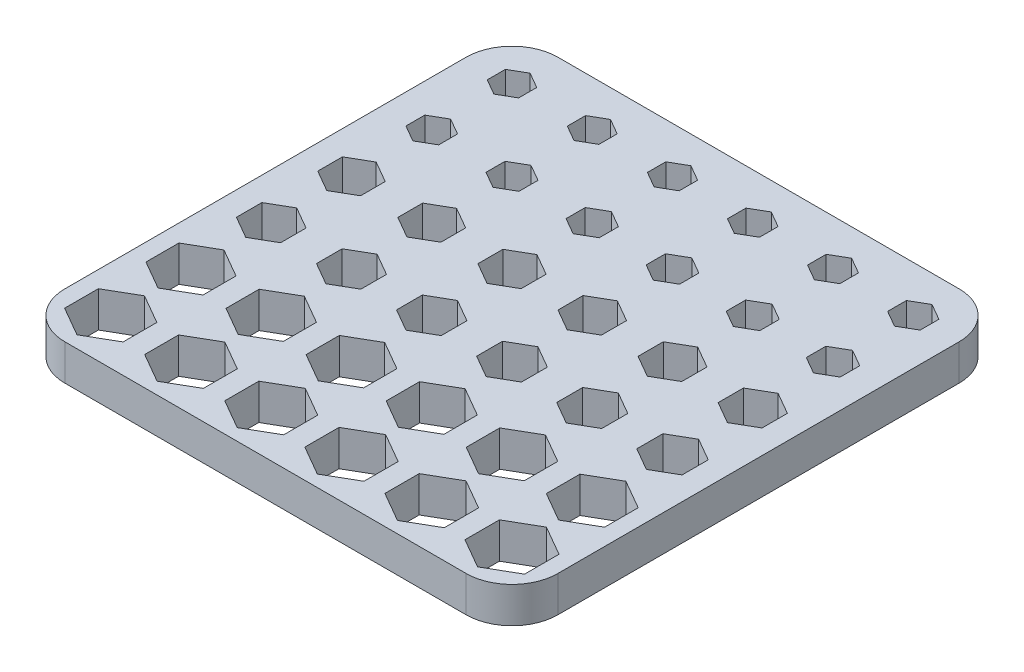
from build123d import *

# Parameters (mm, degrees)
SKETCH1_W           = 109.22
SKETCH1_H           = 109.22
BOSS_EXTRUDE1_DEPTH = 7.9375
FILLET1_R           = 10.16


with BuildPart() as part:
    # Sketch1 → Boss-Extrude1 (new body)
    with BuildSketch(Plane(origin=(0, 0, 0), x_dir=(1, 0, 0), z_dir=(0, 1, 0))):
        with Locations((54.61, 54.61)):
            Rectangle(SKETCH1_W, SKETCH1_H)
        Polygon((10.16, 103.072584371), (6.685, 101.066292185), (6.685, 97.053707815), (10.16, 95.047415629), (13.635, 97.053707815), (13.635, 101.066292185), align=None, mode=Mode.SUBTRACT)
        Polygon((27.94, 103.101451884), (24.44, 101.080725942), (24.44, 97.039274058), (27.94, 95.018548116), (31.44, 97.039274058), (31.44, 101.080725942), align=None, mode=Mode.SUBTRACT)
        Polygon((45.72, 103.130319398), (42.195, 101.095159699), (42.195, 97.024840301), (45.72, 94.989680602), (49.245, 97.024840301), (49.245, 101.095159699), align=None, mode=Mode.SUBTRACT)
        Polygon((63.5, 103.159186911), (59.95, 101.109593456), (59.95, 97.010406544), (63.5, 94.960813089), (67.05, 97.010406544), (67.05, 101.109593456), align=None, mode=Mode.SUBTRACT)
        Polygon((81.28, 103.188054425), (77.705, 101.124027212), (77.705, 96.995972788), (81.28, 94.931945575), (84.855, 96.995972788), (84.855, 101.124027212), align=None, mode=Mode.SUBTRACT)
        Polygon((99.06, 103.216921938), (95.46, 101.138460969), (95.46, 96.981539031), (99.06, 94.903078062), (102.66, 96.981539031), (102.66, 101.138460969), align=None, mode=Mode.SUBTRACT)
        Polygon((10.16, 85.465789452), (6.535, 83.372894726), (6.535, 79.187105274), (10.16, 77.094210548), (13.785, 79.187105274), (13.785, 83.372894726), align=None, mode=Mode.SUBTRACT)
        Polygon((27.94, 85.494656965), (24.29, 83.387328483), (24.29, 79.172671517), (27.94, 77.065343035), (31.59, 79.172671517), (31.59, 83.387328483), align=None, mode=Mode.SUBTRACT)
        Polygon((45.72, 85.523524479), (42.045, 83.401762239), (42.045, 79.158237761), (45.72, 77.036475521), (49.395, 79.158237761), (49.395, 83.401762239), align=None, mode=Mode.SUBTRACT)
        Polygon((63.5, 85.552391992), (59.8, 83.416195996), (59.8, 79.143804004), (63.5, 77.007608008), (67.2, 79.143804004), (67.2, 83.416195996), align=None, mode=Mode.SUBTRACT)
        Polygon((81.28, 85.581259505), (77.555, 83.430629753), (77.555, 79.129370247), (81.28, 76.978740495), (85.005, 79.129370247), (85.005, 83.430629753), align=None, mode=Mode.SUBTRACT)
        Polygon((99.06, 85.610127019), (95.31, 83.445063509), (95.31, 79.114936491), (99.06, 76.949872981), (102.81, 79.114936491), (102.81, 83.445063509), align=None, mode=Mode.SUBTRACT)
        Polygon((10.16, 68.96993192), (5.4229, 66.23496596), (5.4229, 60.76503404), (10.16, 58.03006808), (14.8971, 60.76503404), (14.8971, 66.23496596), align=None, mode=Mode.SUBTRACT)
        Polygon((27.94, 68.999261314), (23.1775, 66.249630657), (23.1775, 60.750369343), (27.94, 58.000738686), (32.7025, 60.750369343), (32.7025, 66.249630657), align=None, mode=Mode.SUBTRACT)
        Polygon((45.72, 69.028590708), (40.9321, 66.264295354), (40.9321, 60.735704646), (45.72, 57.971409292), (50.5079, 60.735704646), (50.5079, 66.264295354), align=None, mode=Mode.SUBTRACT)
        Polygon((63.5, 69.057920101), (58.6867, 66.278960051), (58.6867, 60.721039949), (63.5, 57.942079899), (68.3133, 60.721039949), (68.3133, 66.278960051), align=None, mode=Mode.SUBTRACT)
        Polygon((81.28, 69.087249495), (76.4413, 66.293624748), (76.4413, 60.706375252), (81.28, 57.912750505), (86.1187, 60.706375252), (86.1187, 66.293624748), align=None, mode=Mode.SUBTRACT)
        Polygon((99.06, 69.116578889), (94.1959, 66.308289444), (94.1959, 60.691710556), (99.06, 57.883421111), (103.9241, 60.691710556), (103.9241, 66.308289444), align=None, mode=Mode.SUBTRACT)
        Polygon((10.16, 51.365908282), (5.2705, 48.542954141), (5.2705, 42.897045859), (10.16, 40.074091718), (15.0495, 42.897045859), (15.0495, 48.542954141), align=None, mode=Mode.SUBTRACT)
        Polygon((27.94, 51.395237676), (23.0251, 48.557618838), (23.0251, 42.882381162), (27.94, 40.044762324), (32.8549, 42.882381162), (32.8549, 48.557618838), align=None, mode=Mode.SUBTRACT)
        Polygon((45.72, 51.42456707), (40.7797, 48.572283535), (40.7797, 42.867716465), (45.72, 40.01543293), (50.6603, 42.867716465), (50.6603, 48.572283535), align=None, mode=Mode.SUBTRACT)
        Polygon((63.5, 51.453896463), (58.5343, 48.586948232), (58.5343, 42.853051768), (63.5, 39.986103537), (68.4657, 42.853051768), (68.4657, 48.586948232), align=None, mode=Mode.SUBTRACT)
        Polygon((81.28, 51.483225857), (76.2889, 48.601612929), (76.2889, 42.838387071), (81.28, 39.956774143), (86.2711, 42.838387071), (86.2711, 48.601612929), align=None, mode=Mode.SUBTRACT)
        Polygon((99.06, 51.512555251), (94.0435, 48.616277625), (94.0435, 42.823722375), (99.06, 39.927444749), (104.0765, 42.823722375), (104.0765, 48.616277625), align=None, mode=Mode.SUBTRACT)
        Polygon((10.16, 35.243019025), (3.8354, 31.591509513), (3.8354, 24.288490487), (10.16, 20.636980975), (16.4846, 24.288490487), (16.4846, 31.591509513), align=None, mode=Mode.SUBTRACT)
        Polygon((10.16, 17.638995387), (3.683, 13.899497694), (3.683, 6.420502306), (10.16, 2.681004613), (16.637, 6.420502306), (16.637, 13.899497694), align=None, mode=Mode.SUBTRACT)
        Polygon((27.94, 35.272348419), (21.59, 31.606174209), (21.59, 24.273825791), (27.94, 20.607651581), (34.29, 24.273825791), (34.29, 31.606174209), align=None, mode=Mode.SUBTRACT)
        Polygon((27.94, 17.668324781), (21.4376, 13.91416239), (21.4376, 6.40583761), (27.94, 2.651675219), (34.4424, 6.40583761), (34.4424, 13.91416239), align=None, mode=Mode.SUBTRACT)
        Polygon((45.72, 35.301677812), (39.3446, 31.620838906), (39.3446, 24.259161094), (45.72, 20.578322188), (52.0954, 24.259161094), (52.0954, 31.620838906), align=None, mode=Mode.SUBTRACT)
        Polygon((45.72, 17.697654174), (39.1922, 13.928827087), (39.1922, 6.391172913), (45.72, 2.622345826), (52.2478, 6.391172913), (52.2478, 13.928827087), align=None, mode=Mode.SUBTRACT)
        Polygon((63.5, 35.331007206), (57.0992, 31.635503603), (57.0992, 24.244496397), (63.5, 20.548992794), (69.9008, 24.244496397), (69.9008, 31.635503603), align=None, mode=Mode.SUBTRACT)
        Polygon((63.5, 17.726983568), (56.9468, 13.943491784), (56.9468, 6.376508216), (63.5, 2.593016432), (70.0532, 6.376508216), (70.0532, 13.943491784), align=None, mode=Mode.SUBTRACT)
        Polygon((81.28, 35.3603366), (74.8538, 31.6501683), (74.8538, 24.2298317), (81.28, 20.5196634), (87.7062, 24.2298317), (87.7062, 31.6501683), align=None, mode=Mode.SUBTRACT)
        Polygon((81.28, 17.756312962), (74.7014, 13.958156481), (74.7014, 6.361843519), (81.28, 2.563687038), (87.8586, 6.361843519), (87.8586, 13.958156481), align=None, mode=Mode.SUBTRACT)
        Polygon((99.06, 17.785642355), (92.456, 13.972821178), (92.456, 6.347178822), (99.06, 2.534357645), (105.664, 6.347178822), (105.664, 13.972821178), align=None, mode=Mode.SUBTRACT)
        Polygon((99.06, 35.389665993), (92.6084, 31.664832997), (92.6084, 24.215167003), (99.06, 20.490334007), (105.5116, 24.215167003), (105.5116, 31.664832997), align=None, mode=Mode.SUBTRACT)
    extrude(amount=BOSS_EXTRUDE1_DEPTH)

    # Fillet1
    fillet1_edges = [part.edges().sort_by_distance(p)[0] for p in [
        (0, 3.96875, -109.22),
        (109.22, 3.96875, -109.22),
        (109.22, 3.96875, 0),
        (0, 3.96875, 0),
    ]]
    fillet(fillet1_edges, radius=FILLET1_R)


solid = part.part
